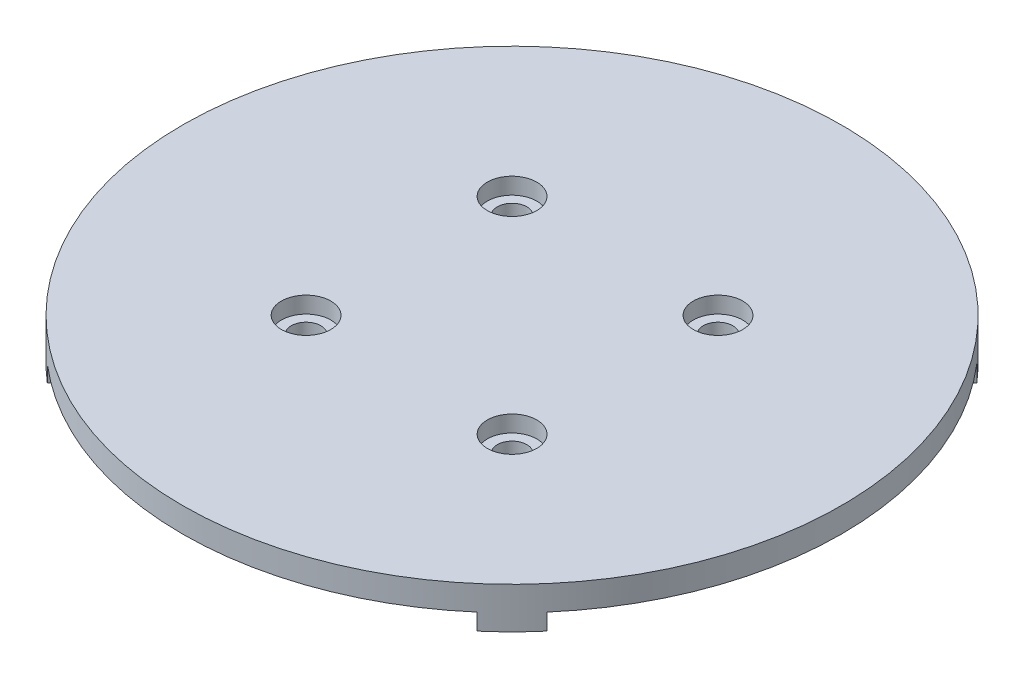
from build123d import *

# Parameters (mm, degrees)
SKETCH_1_R               = 40
EXTRUDE_1_DEPTH          = 3
SKETCH_2_R               = 35
SKETCH_2_R_2             = 30
EXTRUDE_2_DEPTH          = 2
SKETCH_3_R               = 20
SKETCH_3_R_2             = 15
EXTRUDE_3_DEPTH          = 5
EXTRUDE_START            = 2
EXTRUDE_5_DEPTH          = 2
EXTRUDE_4_DEPTH          = 2
CUT_EXTRUDE_2_DEPTH      = 57.789083458
CUT_EXTRUDE_2_DEPTH_BACK = 57.789083458
SKETCH_8_R               = 1.8
CUT_EXTRUDE_3_DEPTH      = 58.131427428
CUT_EXTRUDE_3_DEPTH_BACK = 2
SKETCH_9_R               = 3


with BuildPart() as part:
    # 草图1 → 凸台-拉伸1 (new body)
    with BuildSketch(Plane(origin=(0, 0, 0), x_dir=(1, 0, 0), z_dir=(0, 1, 0))):
        with Locations(Location((0, 0, 0), (0, 0, 270))):
            Circle(SKETCH_1_R)
    extrude(amount=EXTRUDE_1_DEPTH)

    # 草图2 → 凸台-拉伸2 (add)
    with BuildSketch(Plane.XZ):
        with Locations(Location((0, 0, 0), (0, 0, 90))):
            Circle(SKETCH_2_R)
        with Locations(Location((0, 0, 0), (0, 0, 270))):
            Circle(SKETCH_2_R_2, mode=Mode.SUBTRACT)
    extrude(amount=EXTRUDE_2_DEPTH)

    # 草图3 → 凸台-拉伸3 (add)
    with BuildSketch(Plane.XZ):
        with Locations(Location((0, 0, 0), (0, 0, 90))):
            Circle(SKETCH_3_R)
        with Locations(Location((0, 0, 0), (0, 0, 270))):
            Circle(SKETCH_3_R_2, mode=Mode.SUBTRACT)
    extrude(amount=EXTRUDE_3_DEPTH)

    # 草图7 → 凸台-拉伸5 (add)
    with BuildSketch(Plane.XZ.offset(EXTRUDE_START)):
        with BuildLine():
            Line((-26.083289209, 30.325929896), (30.325929896, -26.083289209))
            ThreePointArc((30.325929896, -26.083289209), (28.356463256, -28.211894506), (26.237952221, -30.192215275))
            Line((26.237952221, -30.192215275), (-30.192215275, 26.237952221))
            ThreePointArc((-30.192215275, 26.237952221), (-28.211894506, 28.356463256), (-26.083289209, 30.325929896))
        make_face()
    extrude(amount=-EXTRUDE_5_DEPTH)

    # 草图6 → 凸台-拉伸4 (add)
    with BuildSketch(Plane.XZ.offset(EXTRUDE_START)):
        with BuildLine():
            Line((-30.327162218, -26.081856372), (26.087002686, 30.322735543))
            ThreePointArc((26.087002686, 30.322735543), (28.286671146, 28.281871146), (30.327162218, 26.081856372))
            Line((30.327162218, 26.081856372), (-26.087002686, -30.322735543))
            ThreePointArc((-26.087002686, -30.322735543), (-28.286671146, -28.281871146), (-30.327162218, -26.081856372))
        make_face()
    extrude(amount=-EXTRUDE_4_DEPTH)

    # 草图8 → 切除-拉伸2 (cut, two sides: drawn at the far end of the back side and taken through both)
    with BuildSketch(Plane.XZ.offset(-CUT_EXTRUDE_2_DEPTH_BACK)):
        with Locations(Location((12.5, -12.5, 0), (0, 0, 270))):
            Circle(SKETCH_8_R)
        with Locations(Location((12.5, 12.5, 0), (0, 0, 270))):
            Circle(SKETCH_8_R)
        with Locations(Location((-12.5, -12.5, 0), (0, 0, 270))):
            Circle(SKETCH_8_R)
        with Locations(Location((-12.5, 12.5, 0), (0, 0, 270))):
            Circle(SKETCH_8_R)
    extrude(amount=CUT_EXTRUDE_2_DEPTH + CUT_EXTRUDE_2_DEPTH_BACK, mode=Mode.SUBTRACT)

    # 草图9 → 切除-拉伸3 (cut, two sides: drawn at the far end of the back side and taken through both)
    with BuildSketch(Plane(origin=(0, 3, 0), x_dir=(1, 0, 0), z_dir=(0, 1, 0)).offset(-CUT_EXTRUDE_3_DEPTH_BACK)):
        with Locations(Location((-12.5, 12.5, 0), (0, 0, 90))):
            Circle(SKETCH_9_R)
        with Locations(Location((12.5, 12.5, 0), (0, 0, 90))):
            Circle(SKETCH_9_R)
        with Locations(Location((-12.5, -12.5, 0), (0, 0, 90))):
            Circle(SKETCH_9_R)
        with Locations(Location((12.5, -12.5, 0), (0, 0, 90))):
            Circle(SKETCH_9_R)
    extrude(amount=CUT_EXTRUDE_3_DEPTH + CUT_EXTRUDE_3_DEPTH_BACK, mode=Mode.SUBTRACT)


solid = part.part
